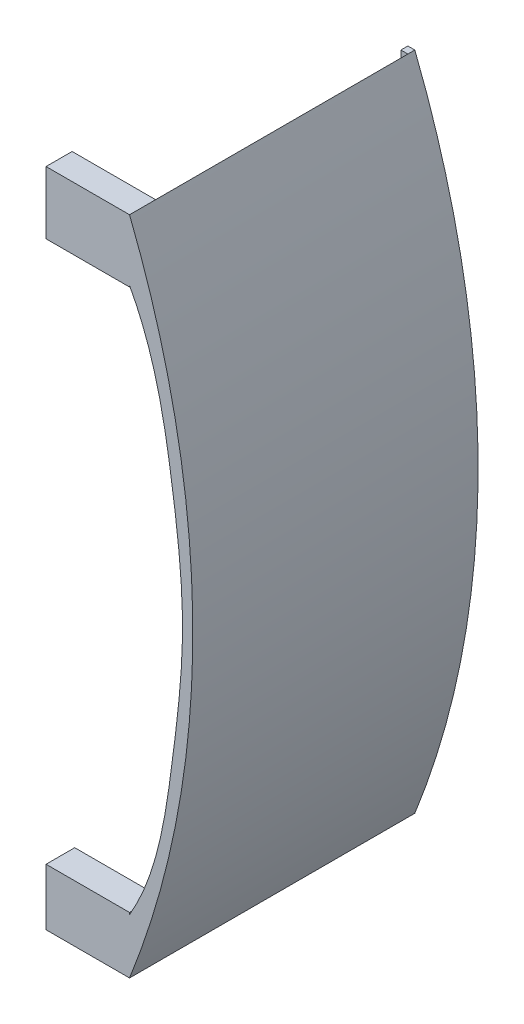
from build123d import *

# Parameters (mm, degrees)
BOSS_EXTRUDE2_DEPTH     = 41
CUT_EXTRUDE1_DEPTH      = 106.056446042
CUT_EXTRUDE1_DEPTH_BACK = 106.056446042
SKETCH7_W               = 7.491980345
SKETCH7_H               = 18
BOSS_EXTRUDE3_DEPTH     = 24
SKETCH9_W               = 8.241980345
SKETCH9_H               = 16.318258018
BOSS_EXTRUDE4_DEPTH     = 24
SKETCH15_W              = 2
SKETCH15_H              = 21.810875259
BOSS_EXTRUDE6_DEPTH     = 2
SKETCH16_W              = 2
SKETCH16_H              = 19.064566639
BOSS_EXTRUDE7_DEPTH     = 2
CUT_EXTRUDE2_DEPTH      = 107.216759506
CUT_EXTRUDE2_DEPTH_BACK = 107.216759506


with BuildPart() as part:
    # Sketch5 → Boss-Extrude2 (new, symmetric)
    with BuildSketch(Plane.XY):
        with BuildLine():
            Line((0, -95), (0, 95))
            ThreePointArc((0, 95), (18.189470994, 0), (0, -95))
        make_face()
    extrude(amount=BOSS_EXTRUDE2_DEPTH, both=True)

    # Sketch6 → Cut-Extrude1 (cut, two sides: drawn at the far end of the back side and taken through both)
    with BuildSketch(Plane.XY.offset(-CUT_EXTRUDE1_DEPTH_BACK)):
        with BuildLine():
            Line((0, 73.189124741), (0, -75.935433361))
            ThreePointArc((0, -75.935433361), (11.848694319, -1.37315431), (0, 73.189124741))
        make_face()
    extrude(amount=CUT_EXTRUDE1_DEPTH + CUT_EXTRUDE1_DEPTH_BACK, mode=Mode.SUBTRACT)

    # Sketch7 → Boss-Extrude3 (add)
    with BuildSketch(Plane.ZY):
        with Locations((37.254009827, 86)):
            Rectangle(SKETCH7_W, SKETCH7_H)
    extrude(amount=BOSS_EXTRUDE3_DEPTH)

    # Sketch9 → Boss-Extrude4 (add)
    with BuildSketch(Plane.ZY):
        with Locations((36.879009827, -86.840870991)):
            Rectangle(SKETCH9_W, SKETCH9_H)
    extrude(amount=BOSS_EXTRUDE4_DEPTH)

    # Sketch15 → Boss-Extrude6 (add)
    with BuildSketch(Plane.XY.offset(-41)):
        with Locations((-1, 84.094562371)):
            Rectangle(SKETCH15_W, SKETCH15_H)
    extrude(amount=BOSS_EXTRUDE6_DEPTH)

    # Sketch16 → Boss-Extrude7 (add)
    with BuildSketch(Plane.XY.offset(-41)):
        with Locations((-1, -85.467716681)):
            Rectangle(SKETCH16_W, SKETCH16_H)
    extrude(amount=BOSS_EXTRUDE7_DEPTH)

    # Sketch18 → Cut-Extrude2 (cut, two sides: drawn at the far end of the back side and taken through both)
    with BuildSketch(Plane.XY.offset(-CUT_EXTRUDE2_DEPTH_BACK)):
        with BuildLine():
            Line((0, 77.403954958), (0, -79.233152756))
            add(Edge.make_bspline(
                [(0, 77.403954958), (7.29967651, 63.999105608), (12.069881817, 37.679146823), (16.580904834, -0.041757284), (12.014730591, -38.310384751), (8.094731037, -65.45608458), (0, -79.233152756)],
                knots=[0, 0, 0, 0, 0.282270796, 0.494146488, 0.70668985, 1, 1, 1, 1], degree=3))
        make_face()
    extrude(amount=CUT_EXTRUDE2_DEPTH + CUT_EXTRUDE2_DEPTH_BACK, mode=Mode.SUBTRACT)


solid = part.part
